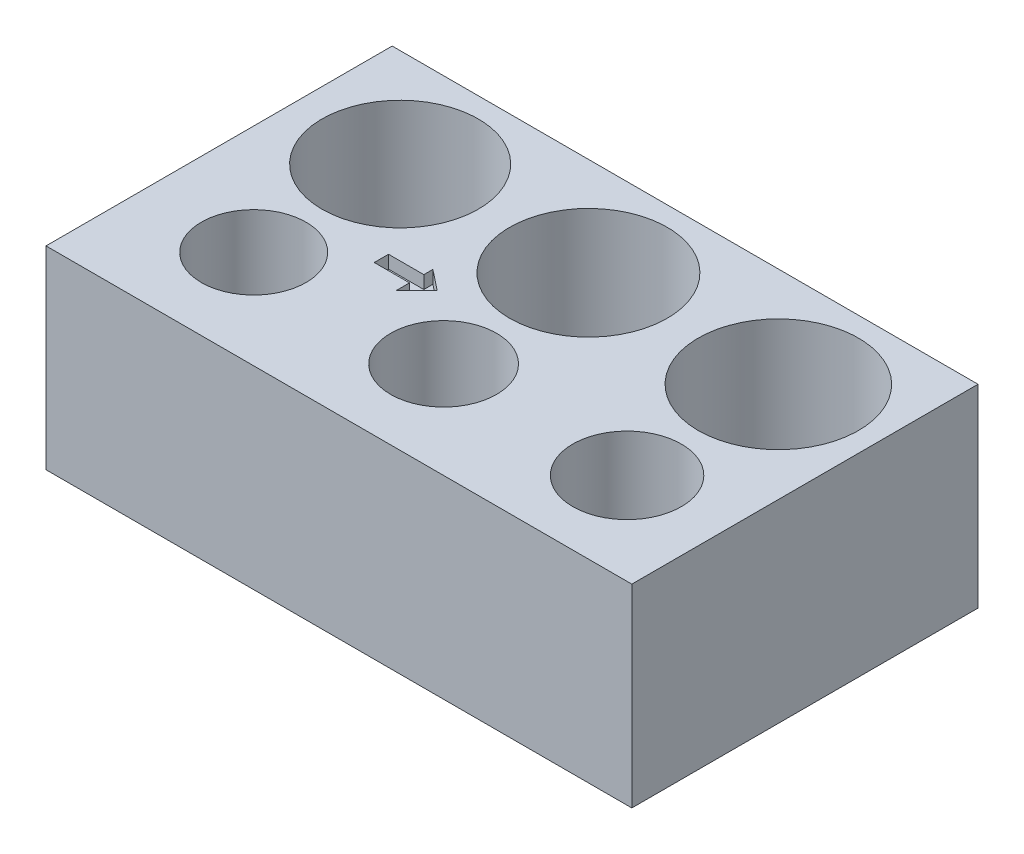
from build123d import *

# Parameters (mm, degrees)
SKETCH1_W           = 45.323908176
SKETCH1_H           = 26.783449256
SKETCH1_R           = 4.05
SKETCH1_R_2         = 4.1
SKETCH1_R_3         = 4.2
SKETCH1_R_4         = 6.05
SKETCH1_R_5         = 6.1
SKETCH1_R_6         = 6.2
BOSS_EXTRUDE1_DEPTH = 15
CUT_EXTRUDE1_DEPTH  = 1


with BuildPart() as part:
    # Sketch1 → Boss-Extrude1 (new body)
    with BuildSketch(Plane(origin=(0, 0, 0), x_dir=(1, 0, 0), z_dir=(0, 1, 0))):
        Rectangle(SKETCH1_W, SKETCH1_H)
        with Locations(Location((-14.194850363, -5.790004753, 0), (0, 0, 270))):
            Circle(SKETCH1_R, mode=Mode.SUBTRACT)
        with Locations(Location((0.622581156, -5.914520985, 0), (0, 0, 270))):
            Circle(SKETCH1_R_2, mode=Mode.SUBTRACT)
        with Locations(Location((15.190980213, -6.288069678, 0), (0, 0, 270))):
            Circle(SKETCH1_R_3, mode=Mode.SUBTRACT)
        with Locations(Location((-14.443882825, 5.790004753, 0), (0, 0, 270))):
            Circle(SKETCH1_R_4, mode=Mode.SUBTRACT)
        with Locations(Location((0.124516231, 5.790004753, 0), (0, 0, 270))):
            Circle(SKETCH1_R_5, mode=Mode.SUBTRACT)
        with Locations(Location((14.94194775, 5.665488522, 0), (0, 0, 270))):
            Circle(SKETCH1_R_6, mode=Mode.SUBTRACT)
    extrude(amount=BOSS_EXTRUDE1_DEPTH)

    # Sketch2 → Cut-Extrude1 (cut)
    with BuildSketch(Plane(origin=(0, 15, 0), x_dir=(1, 0, 0), z_dir=(0, 1, 0))):
        Polygon((-6.12211696, 0), (-6.12211696, -0.70072423), (-8.851253436, -0.70072423), (-8.851253436, -1.80713091), (-6.12211696, -1.80713091), (-6.12211696, -2.839777144), (-4.536267386, -1.25392757), align=None)
    extrude(amount=-CUT_EXTRUDE1_DEPTH, mode=Mode.SUBTRACT)


solid = part.part
